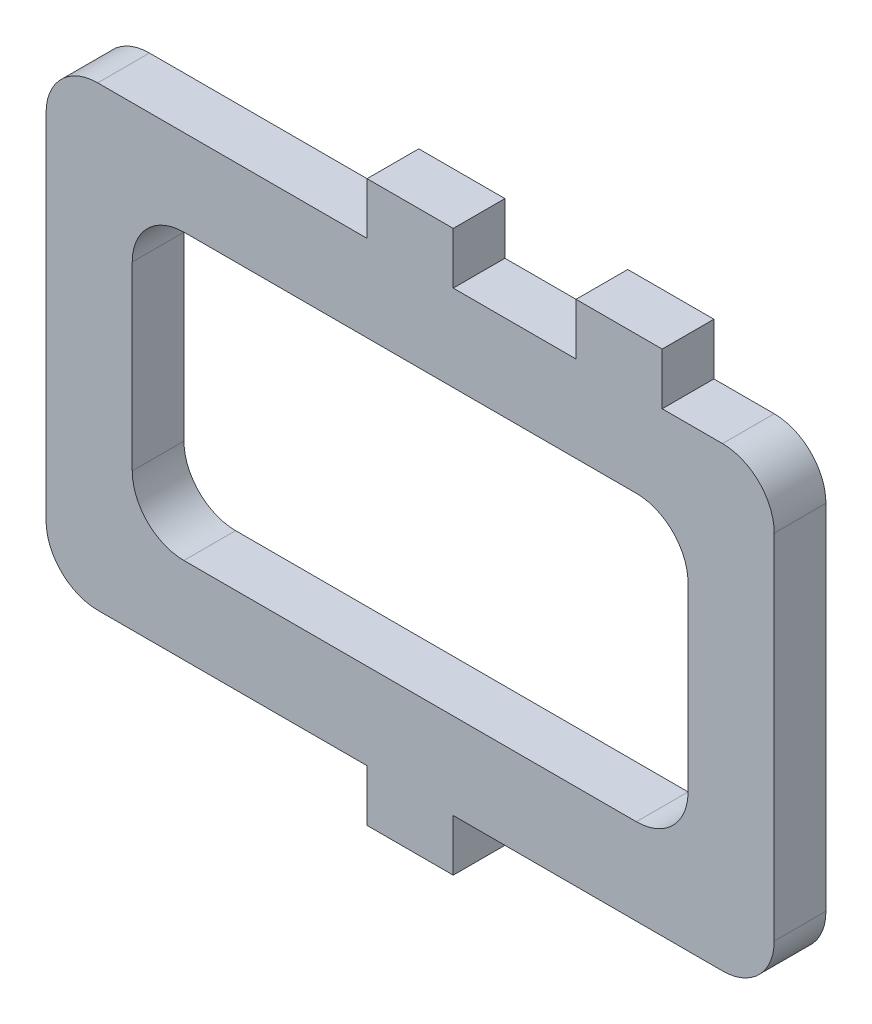
from build123d import *

# Parameters (mm, degrees)
SALIENTE_EXTRUIR1_DEPTH = 3
CORTAR_EXTRUIR1_DEPTH   = 4


with BuildPart() as part:
    # Croquis1 → Saliente-Extruir1 (new body)
    with BuildSketch(Plane.XY):
        with BuildLine():
            Line((-102.615102368, -90.721952824), (-86.990102368, -90.721952824))
            ThreePointArc((-86.990102368, -90.721952824), (-84.868782024, -89.843273168), (-83.990102368, -87.721952824))
            Line((-83.990102368, -87.721952824), (-83.990102368, -67.221952824))
            ThreePointArc((-83.990102368, -67.221952824), (-84.868782024, -65.10063248), (-86.990102368, -64.221952824))
            Line((-86.990102368, -64.221952824), (-90.490102368, -64.221952824))
            Line((-90.490102368, -64.221952824), (-90.490102368, -61.221952824))
            Line((-90.490102368, -61.221952824), (-95.490102368, -61.221952824))
            Line((-95.490102368, -61.221952824), (-95.490102368, -64.221952824))
            Line((-95.490102368, -64.221952824), (-102.615102368, -64.221952824))
            Line((-102.615102368, -64.221952824), (-102.615102368, -61.221952824))
            Line((-102.615102368, -61.221952824), (-105.115102368, -61.221952824))
            Line((-105.115102368, -61.221952824), (-107.615102368, -61.221952824))
            Line((-107.615102368, -61.221952824), (-107.615102368, -64.221952824))
            Line((-107.615102368, -64.221952824), (-123.240102368, -64.221952824))
            ThreePointArc((-123.240102368, -64.221952824), (-125.361422711, -65.10063248), (-126.240102368, -67.221952824))
            Line((-126.240102368, -67.221952824), (-126.240102368, -87.721952824))
            ThreePointArc((-126.240102368, -87.721952824), (-125.361422711, -89.843273168), (-123.240102368, -90.721952824))
            Line((-123.240102368, -90.721952824), (-107.615102368, -90.721952824))
            Line((-107.615102368, -90.721952824), (-107.615102368, -93.721952824))
            Line((-107.615102368, -93.721952824), (-102.615102368, -93.721952824))
            Line((-102.615102368, -93.721952824), (-102.615102368, -90.721952824))
        make_face()
    extrude(amount=SALIENTE_EXTRUIR1_DEPTH)

    # Croquis2 → Cortar-Extruir1 (cut)
    with BuildSketch(Plane.XY.offset(3)):
        with BuildLine():
            Line((-115.427602368, -69.221952824), (-91.990102368, -69.221952824))
            ThreePointArc((-91.990102368, -69.221952824), (-89.868782024, -70.10063248), (-88.990102368, -72.221952824))
            Line((-88.990102368, -72.221952824), (-88.990102368, -82.721952824))
            ThreePointArc((-88.990102368, -82.721952824), (-89.868782024, -84.843273168), (-91.990102368, -85.721952824))
            Line((-91.990102368, -85.721952824), (-118.240102368, -85.721952824))
            ThreePointArc((-118.240102368, -85.721952824), (-120.361422711, -84.843273168), (-121.240102368, -82.721952824))
            Line((-121.240102368, -82.721952824), (-121.240102368, -72.221952824))
            ThreePointArc((-121.240102368, -72.221952824), (-120.361422711, -70.10063248), (-118.240102368, -69.221952824))
            Line((-118.240102368, -69.221952824), (-115.427602368, -69.221952824))
        make_face()
    extrude(amount=-CORTAR_EXTRUIR1_DEPTH, mode=Mode.SUBTRACT)


solid = part.part
